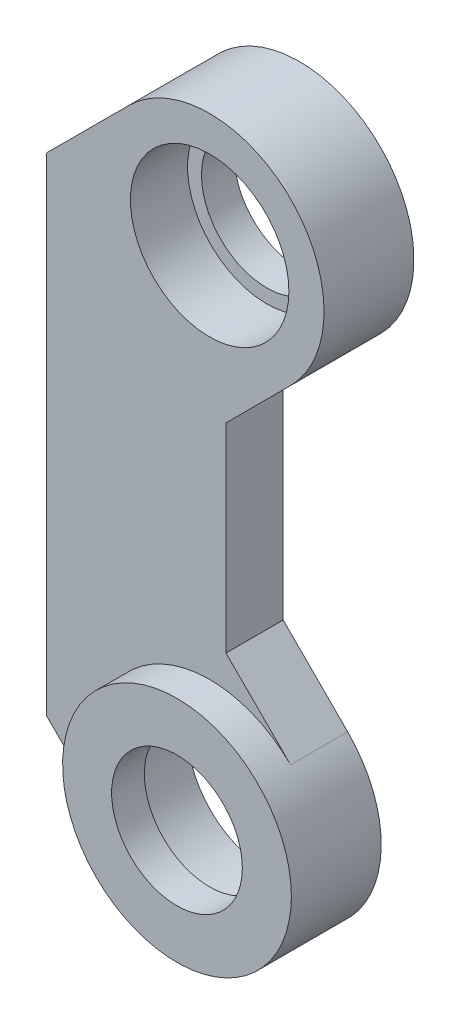
from build123d import *

# Parameters (mm, degrees)
CROQUIS1_R              = 7
CROQUIS1_R_2            = 4.85
SALIENTE_EXTRUIR1_DEPTH = 3.5
CROQUIS4_W              = 8.235883517
CROQUIS4_H              = 32.578937154
CORTAR_EXTRUIR4_DEPTH   = 4
CROQUIS5_R              = 7
CROQUIS5_R_2            = 4
SALIENTE_EXTRUIR2_DEPTH = 2
SALIENTE_EXTRUIR3_START = 2
CROQUIS6_R              = 7
CROQUIS6_R_2            = 4
SALIENTE_EXTRUIR3_DEPTH = 2


with BuildPart() as part:
    # Croquis1 → Saliente-Extruir1 (new body)
    # profile 1 of 3: a face of its own
    with BuildSketch(Plane.XY):
        with BuildLine():
            ThreePointArc((-4.949747468, -4.949747468), (-4.949747468, 4.949747468), (4.949747468, 4.949747468))
            Line((4.949747468, 4.949747468), (1, 8.899494937))
            Line((1, 8.899494937), (1, 21.100505063))
            Line((1, 21.100505063), (4.949747468, 25.050252532))
            ThreePointArc((4.949747468, 25.050252532), (-4.949747468, 25.050252532), (-4.949747468, 34.949747468))
            Line((-4.949747468, 34.949747468), (-13, 26.899494937))
            Line((-13, 26.899494937), (-13, 3.100505063))
            Line((-13, 3.100505063), (-4.949747468, -4.949747468))
        make_face()
    # profile 2 of 3: a face of its own
    with BuildSketch(Plane.XY):
        with Locations((0, 30)):
            Circle(CROQUIS1_R)
        with Locations((0, 30)):
            Circle(CROQUIS1_R_2, mode=Mode.SUBTRACT)
    # profile 3 of 3: a face of its own
    with BuildSketch(Plane.XY):
        Circle(CROQUIS1_R)
        Circle(CROQUIS1_R_2, mode=Mode.SUBTRACT)
    extrude(amount=SALIENTE_EXTRUIR1_DEPTH)

    # Croquis4 → Cortar-Extruir4 (cut)
    with BuildSketch(Plane.XY.offset(3.5)):
        with Locations((-14.117941759, 13.61002636)):
            Rectangle(CROQUIS4_W, CROQUIS4_H)
    extrude(amount=-CORTAR_EXTRUIR4_DEPTH, mode=Mode.SUBTRACT)

    # Croquis5 → Saliente-Extruir2 (add)
    with BuildSketch(Plane.XY.offset(3.5)):
        with Locations(Location((0, 0, 0), (0, 0, 225))):
            Circle(CROQUIS5_R)
        Circle(CROQUIS5_R_2, mode=Mode.SUBTRACT)
    extrude(amount=SALIENTE_EXTRUIR2_DEPTH)

    # Croquis6 → Saliente-Extruir3 (add)
    with BuildSketch(Plane(origin=(0, 0, 0), x_dir=(-1, 0, 0), z_dir=(0, 0, -1)).offset(SALIENTE_EXTRUIR3_START)):
        with Locations((0, 30)):
            Circle(CROQUIS6_R)
        with Locations((0, 30)):
            Circle(CROQUIS6_R_2, mode=Mode.SUBTRACT)
    extrude(amount=-SALIENTE_EXTRUIR3_DEPTH)


solid = part.part
